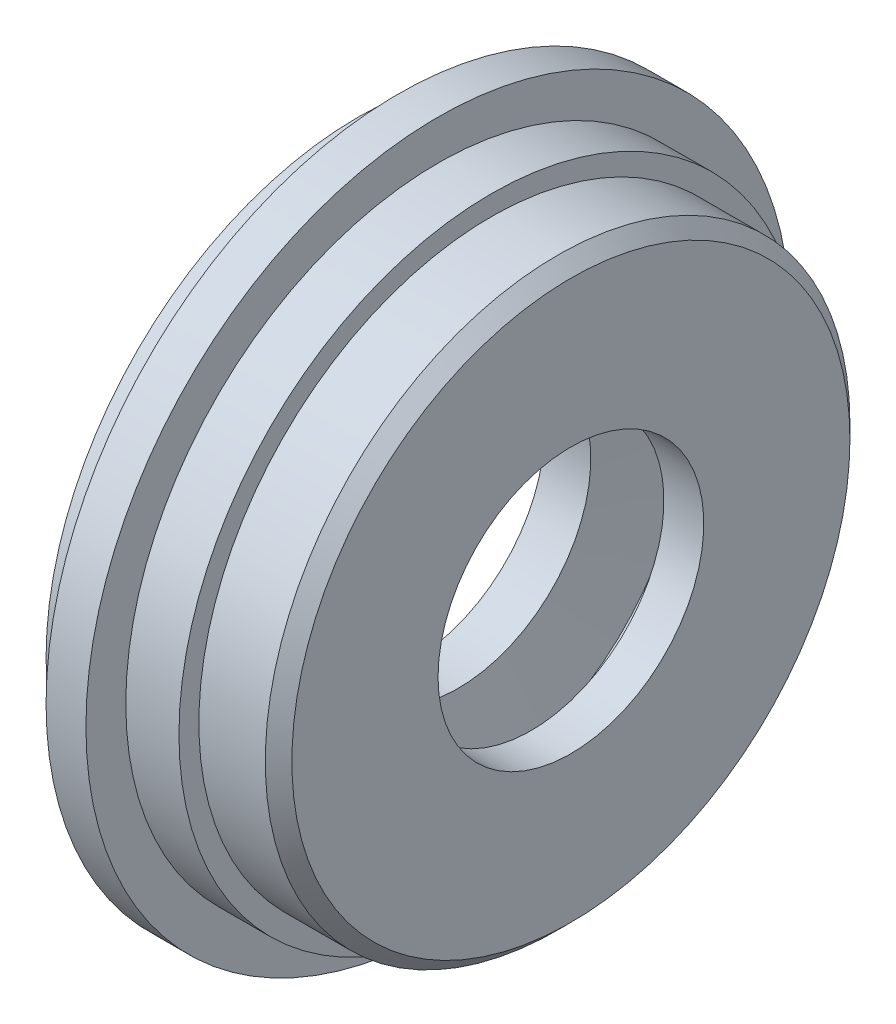
from build123d import *

# Parameters (mm, degrees)
SKETCH_1_R          = 23.5
EXTRUDE_1_DEPTH     = 10
SKETCH_2_R          = 22
EXTRUDE_2_DEPTH     = 6
EXTRUDE_START       = -3
SKETCH_3_R          = 26.5
EXTRUDE_3_DEPTH     = 3
SKETCH_4_R          = 18.5
CUT_EXTRUDE_1_DEPTH = 4
SKETCH_5_R          = 10
CUT_EXTRUDE_2_DEPTH = 40.35098474
CHAMFER_1_SIZE      = 1


with BuildPart() as part:
    # 草图1 → 凸台-拉伸1 (new body)
    with BuildSketch(Plane(origin=(0, 0, 0), x_dir=(0, 0, -1), z_dir=(1, 0, 0))):
        Circle(SKETCH_1_R)
    extrude(amount=EXTRUDE_1_DEPTH)

    # 草图2 → 凸台-拉伸2 (add)
    with BuildSketch(Plane(origin=(10, 0, 0), x_dir=(0, 0, -1), z_dir=(1, 0, 0))):
        Circle(SKETCH_2_R)
    extrude(amount=EXTRUDE_2_DEPTH)

    # 草图3 → 凸台-拉伸3 (add)
    with BuildSketch(Plane.ZY.offset(EXTRUDE_START)):
        Circle(SKETCH_3_R)
    extrude(amount=-EXTRUDE_3_DEPTH)

    # 草图4 → 切除-拉伸1 (cut)
    with BuildSketch(Plane.ZY):
        Circle(SKETCH_4_R)
    extrude(amount=-CUT_EXTRUDE_1_DEPTH, mode=Mode.SUBTRACT)

    # 草图5 → 切除-拉伸2 (cut, through all)
    with BuildSketch(Plane.ZY.offset(-4)):
        Circle(SKETCH_5_R)
    extrude(amount=-CUT_EXTRUDE_2_DEPTH, mode=Mode.SUBTRACT)

    # 草图7 → 切除-旋转1 (revolve, cut)
    with BuildSketch(Plane(origin=(0, 0, 0), x_dir=(1, 0, 0), z_dir=(0, 1, 0))):
        Polygon((13, 0), (7.5, 0), (7.5, -10), (8.25, -16.5), (12.25, -16.5), (13, -10), align=None)
    revolve(axis=Axis((0, 0, 0), (1, 0, 0)), mode=Mode.SUBTRACT)

    # 倒角1
    chamfer_1_edges = [part.edges().sort_by_distance(p)[0] for p in [
        (16, 0, 22),
    ]]
    chamfer(chamfer_1_edges, length=CHAMFER_1_SIZE)


solid = part.part
